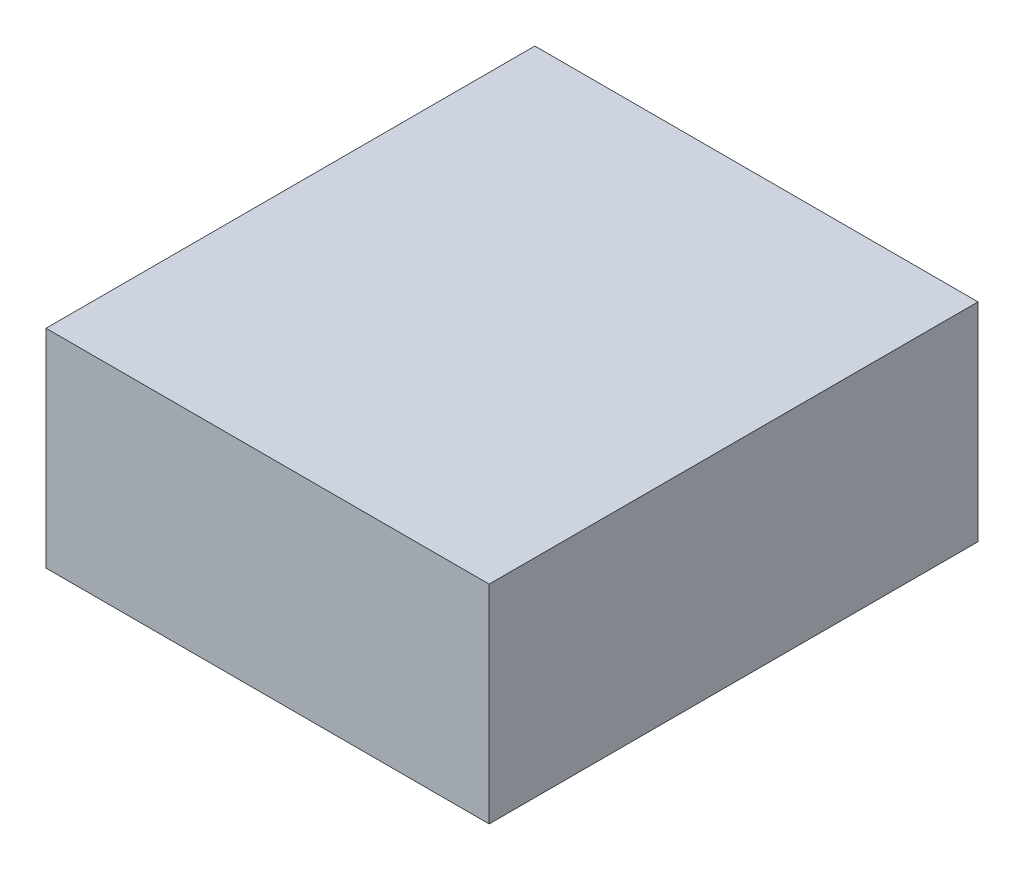
from build123d import *

# Parameters (mm, degrees)
SKETCH1_W           = 64
SKETCH1_H           = 70.6
BOSS_EXTRUDE1_DEPTH = 30


with BuildPart() as part:
    # Sketch1 → Boss-Extrude1 (new body)
    with BuildSketch(Plane(origin=(0, 0, 0), x_dir=(1, 0, 0), z_dir=(0, 1, 0))):
        Rectangle(SKETCH1_W, SKETCH1_H)
    extrude(amount=BOSS_EXTRUDE1_DEPTH)


solid = part.part
